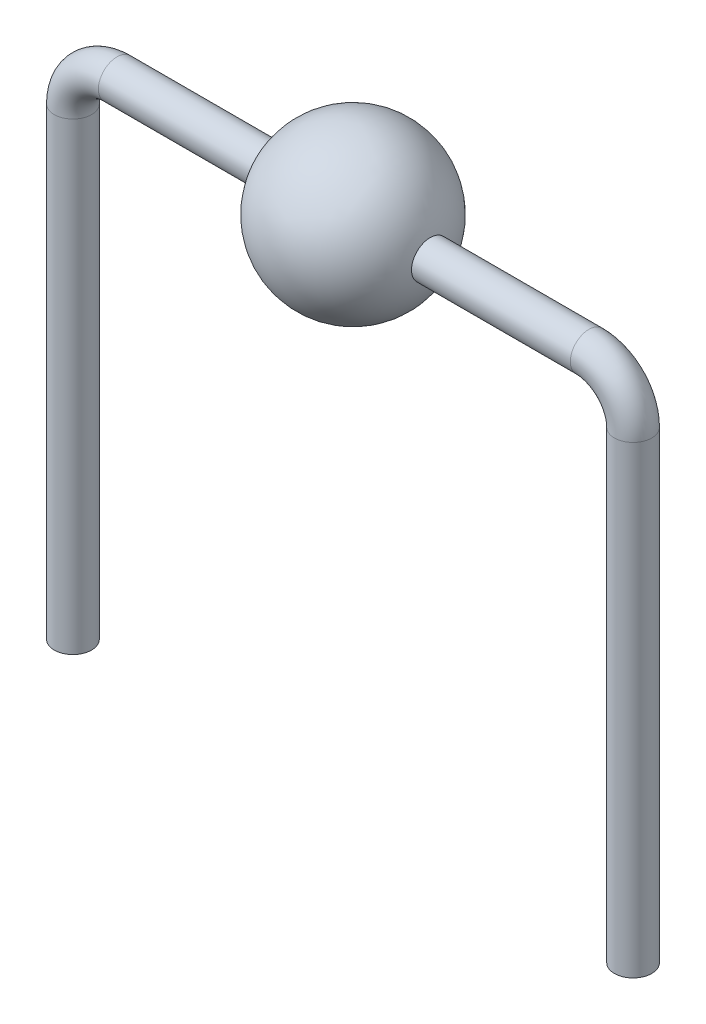
from build123d import *

# Parameters (mm, degrees)
SKETCH_3_R = 0.423054932
SKETCH_5_R = 0.423054932


with BuildPart() as part:
    # Эскиз1 → Повернуть2 (revolve)
    with BuildSketch(Plane(origin=(0, 0, 0), x_dir=(1, 0, 0), z_dir=(0, 1, 0))):
        with BuildLine():
            ThreePointArc((-1.749578385, 0.423054932), (0, 1.8), (1.749578385, 0.423054932))
            Line((1.749578385, 0.423054932), (1.749578385, 0))
            Line((1.749578385, 0), (-1.749578385, 0))
            Line((-1.749578385, 0), (-1.749578385, 0.423054932))
        make_face()
    revolve(axis=Axis((-29.751182373, 0, 0), (1, 0, 0)))

    # По траектории1: sweep along a path in Эскиз2
    with BuildLine(Plane.XY) as sweep_1_path:
        Line((-0.817553267, 0), (-5.35, 0))
        ThreePointArc((-5.35, 0), (-6.057106781, -0.292893219), (-6.35, -1))
        Line((-6.35, -1), (-6.35, -11.514871198))
    # Эскиз3 → По траектории1 (sweep)
    with BuildSketch(Plane.ZY.offset(1.749578385)):
        Circle(SKETCH_3_R)
    sweep(path=sweep_1_path.line)

    # По траектории2: sweep along a path in Эскиз4
    with BuildLine(Plane.XY) as sweep_2_path:
        Line((6.35, -11.514871198), (6.35, -1))
        ThreePointArc((6.35, -1), (6.057106781, -0.292893219), (5.35, 0))
        Line((5.35, 0), (0.821594736, 0))
    # Эскиз5 → По траектории2 (sweep)
    with BuildSketch(Plane(origin=(1.749578385, 0, 0), x_dir=(0, 0, -1), z_dir=(1, 0, 0))):
        Circle(SKETCH_5_R)
    sweep(path=sweep_2_path.line)


solid = part.part
